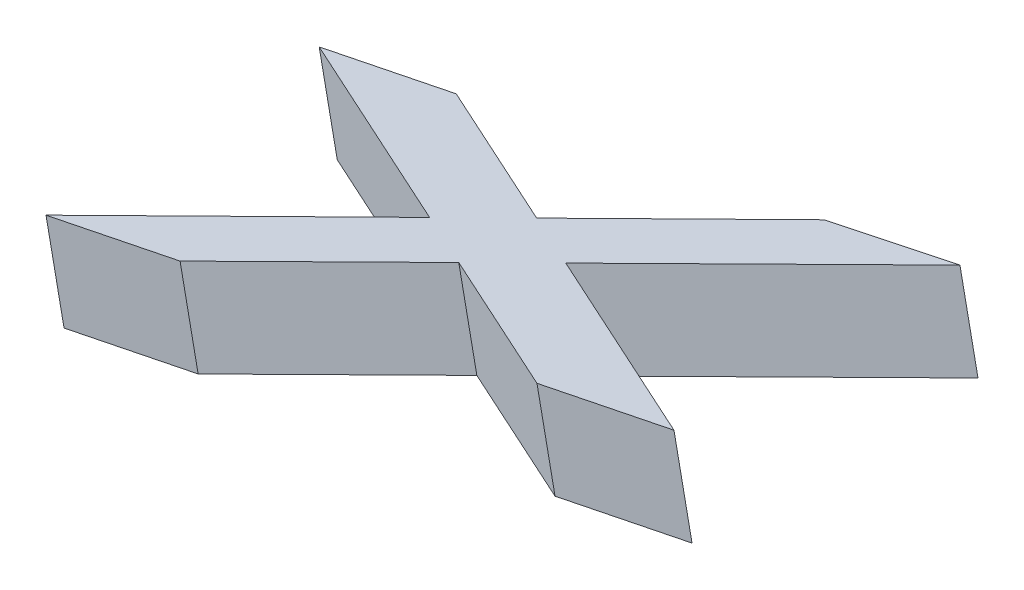
from build123d import *

# Parameters (mm, degrees)
BOSS_EXTRUDE1_DEPTH = 8.89


with BuildPart() as part:
    # Sketch1 → Boss-Extrude1 (new body)
    with BuildSketch(Plane(origin=(-2.610511813, 12.831812333, 0), x_dir=(-0.9799269411601921, -0.1993569411593923, 0), z_dir=(0.1993569411593923, -0.9799269411601921, 0))):
        Polygon((14.519565306, -38.619437862), (39.524488362, -52.806340813), (14.519565306, -66.689059093), (28.244363997, -66.689059093), (46.312521308, -56.657628994), (63.993275074, -66.689059093), (77.42379718, -66.689059093), (53.05582366, -52.913751574), (78.568625867, -38.749059093), (64.843827175, -38.749059093), (46.25530748, -49.069394077), (27.999043564, -38.749059093), align=None)
    extrude(amount=-BOSS_EXTRUDE1_DEPTH)


solid = part.part
